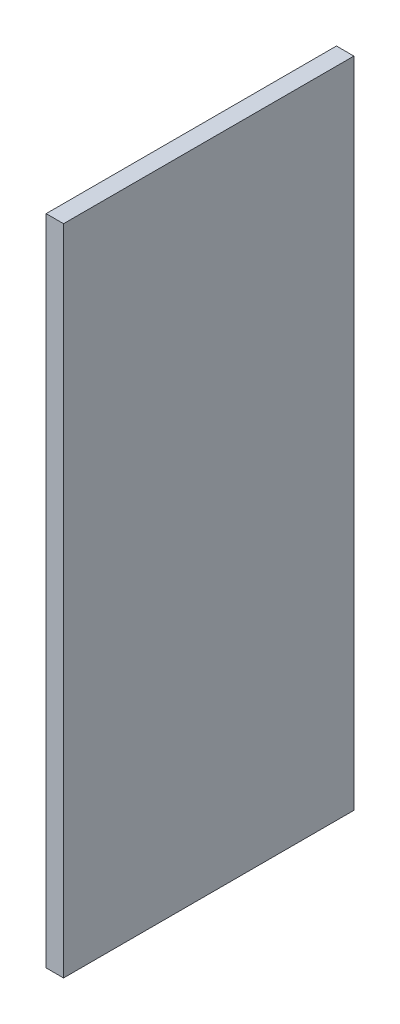
from build123d import *

# Parameters (mm, degrees)
SURFACE_EXTRUDE1_1_BACK  = 12.7
SURFACE_EXTRUDE1_1_DEPTH = 25.4
THICKEN1_T1              = 0.762
THICKEN1_T2              = 0.762


with BuildPart() as body_1:
    # Surface-Extrude1: a surface, the sketch's curves swept straight by 25.4 mm
    with BuildLine(Plane.XY.offset(-SURFACE_EXTRUDE1_1_BACK), mode=Mode.PRIVATE) as surface_extrude1_1_path:
        Line((0, 0), (0, 57.15))
    surface_extrude1_1 = Shell.extrude(surface_extrude1_1_path.wire(), (0 * SURFACE_EXTRUDE1_1_DEPTH, 0 * SURFACE_EXTRUDE1_1_DEPTH, 1 * SURFACE_EXTRUDE1_1_DEPTH))
    add(Solid.thicken(surface_extrude1_1, THICKEN1_T1))
    add(Solid.thicken(surface_extrude1_1, -THICKEN1_T2))


solid = body_1.part
